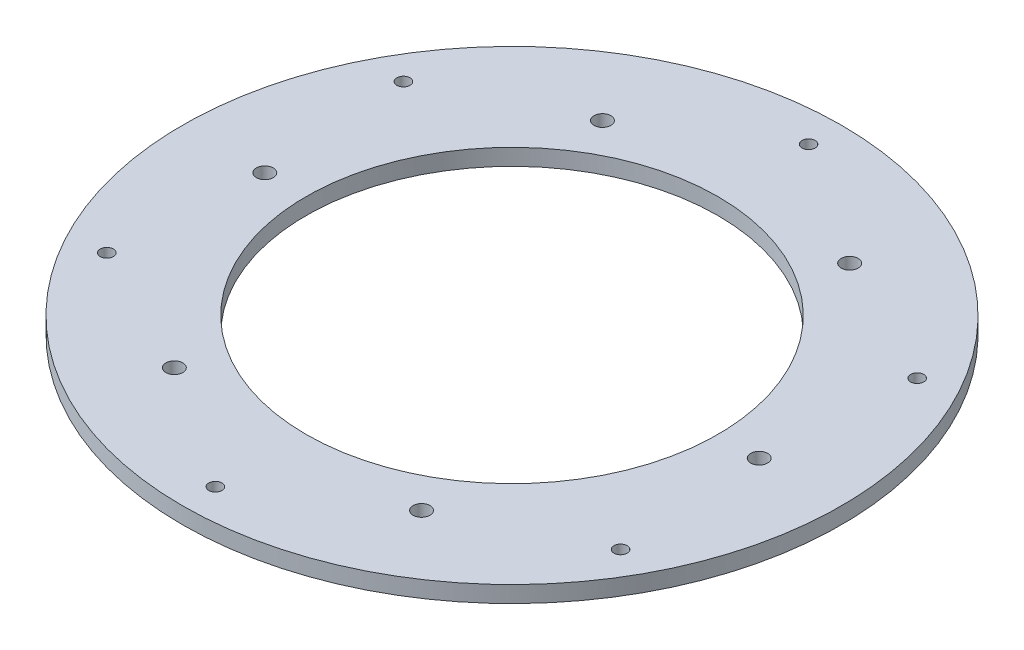
from build123d import *

# Parameters (mm, degrees)
SKETCH_1_R      = 80
SKETCH_1_R_2    = 50
SKETCH_1_R_3    = 2.05
EXTRUDE_1_DEPTH = 4
EXTRUDE_START   = -4
SKETCH_2_R      = 2.05
SKETCH_2_R_2    = 1.6
EXTRUDE_2_DEPTH = 4


with BuildPart() as part:
    # 草图1 → 凸台-拉伸1 (new body)
    with BuildSketch(Plane(origin=(0, 0, 0), x_dir=(1, 0, 0), z_dir=(0, 1, 0))):
        with Locations(Location((0, 0, 0), (0, 0, 270))):
            Circle(SKETCH_1_R)
        with Locations(Location((0, 0, 0), (0, 0, 270))):
            Circle(SKETCH_1_R_2, mode=Mode.SUBTRACT)
        with Locations(Location((60, 0, 0), (0, 0, 270))):
            Circle(SKETCH_1_R_3, mode=Mode.SUBTRACT)
        with Locations(Location((30, -51.961524227, 0), (0, 0, 270))):
            Circle(SKETCH_1_R_3, mode=Mode.SUBTRACT)
        with Locations(Location((-30, -51.961524227, 0), (0, 0, 270))):
            Circle(SKETCH_1_R_3, mode=Mode.SUBTRACT)
        with Locations(Location((-60, 0, 0), (0, 0, 270))):
            Circle(SKETCH_1_R_3, mode=Mode.SUBTRACT)
        with Locations(Location((-30, 51.961524227, 0), (0, 0, 270))):
            Circle(SKETCH_1_R_3, mode=Mode.SUBTRACT)
        with Locations(Location((30, 51.961524227, 0), (0, 0, 270))):
            Circle(SKETCH_1_R_3, mode=Mode.SUBTRACT)
        with Locations(Location((-62.353829072, 36, 0), (0, 0, 270))):
            Circle(SKETCH_1_R_3, mode=Mode.SUBTRACT)
        with Locations(Location((0, 72, 0), (0, 0, 270))):
            Circle(SKETCH_1_R_3, mode=Mode.SUBTRACT)
        with Locations(Location((62.353829072, 36, 0), (0, 0, 270))):
            Circle(SKETCH_1_R_3, mode=Mode.SUBTRACT)
        with Locations(Location((62.353829072, -36, 0), (0, 0, 270))):
            Circle(SKETCH_1_R_3, mode=Mode.SUBTRACT)
        with Locations(Location((0, -72, 0), (0, 0, 270))):
            Circle(SKETCH_1_R_3, mode=Mode.SUBTRACT)
        with Locations(Location((-62.353829072, -36, 0), (0, 0, 270))):
            Circle(SKETCH_1_R_3, mode=Mode.SUBTRACT)
    extrude(amount=EXTRUDE_1_DEPTH)

    # 草图2 → 凸台-拉伸2 (add)
    # profile 1 of 6: a face of its own
    with BuildSketch(Plane(origin=(0, 4, 0), x_dir=(1, 0, 0), z_dir=(0, 1, 0)).offset(EXTRUDE_START)):
        with Locations((62.353829072, 36)):
            Circle(SKETCH_2_R)
        with Locations(Location((62.353829072, 36, 0), (0, 0, 270))):
            Circle(SKETCH_2_R_2, mode=Mode.SUBTRACT)
    # profile 2 of 6: a face of its own
    with BuildSketch(Plane(origin=(0, 4, 0), x_dir=(1, 0, 0), z_dir=(0, 1, 0)).offset(EXTRUDE_START)):
        with Locations((62.353829072, -36)):
            Circle(SKETCH_2_R)
        with Locations(Location((62.353829072, -36, 0), (0, 0, 270))):
            Circle(SKETCH_2_R_2, mode=Mode.SUBTRACT)
    # profile 3 of 6: a face of its own
    with BuildSketch(Plane(origin=(0, 4, 0), x_dir=(1, 0, 0), z_dir=(0, 1, 0)).offset(EXTRUDE_START)):
        with Locations((0, -72)):
            Circle(SKETCH_2_R)
        with Locations(Location((0, -72, 0), (0, 0, 270))):
            Circle(SKETCH_2_R_2, mode=Mode.SUBTRACT)
    # profile 4 of 6: a face of its own
    with BuildSketch(Plane(origin=(0, 4, 0), x_dir=(1, 0, 0), z_dir=(0, 1, 0)).offset(EXTRUDE_START)):
        with Locations((-62.353829072, -36)):
            Circle(SKETCH_2_R)
        with Locations(Location((-62.353829072, -36, 0), (0, 0, 270))):
            Circle(SKETCH_2_R_2, mode=Mode.SUBTRACT)
    # profile 5 of 6: a face of its own
    with BuildSketch(Plane(origin=(0, 4, 0), x_dir=(1, 0, 0), z_dir=(0, 1, 0)).offset(EXTRUDE_START)):
        with Locations((-62.353829072, 36)):
            Circle(SKETCH_2_R)
        with Locations(Location((-62.353829072, 36, 0), (0, 0, 270))):
            Circle(SKETCH_2_R_2, mode=Mode.SUBTRACT)
    # profile 6 of 6: a face of its own
    with BuildSketch(Plane(origin=(0, 4, 0), x_dir=(1, 0, 0), z_dir=(0, 1, 0)).offset(EXTRUDE_START)):
        with Locations((0, 72)):
            Circle(SKETCH_2_R)
        with Locations(Location((0, 72, 0), (0, 0, 270))):
            Circle(SKETCH_2_R_2, mode=Mode.SUBTRACT)
    extrude(amount=EXTRUDE_2_DEPTH)


solid = part.part
